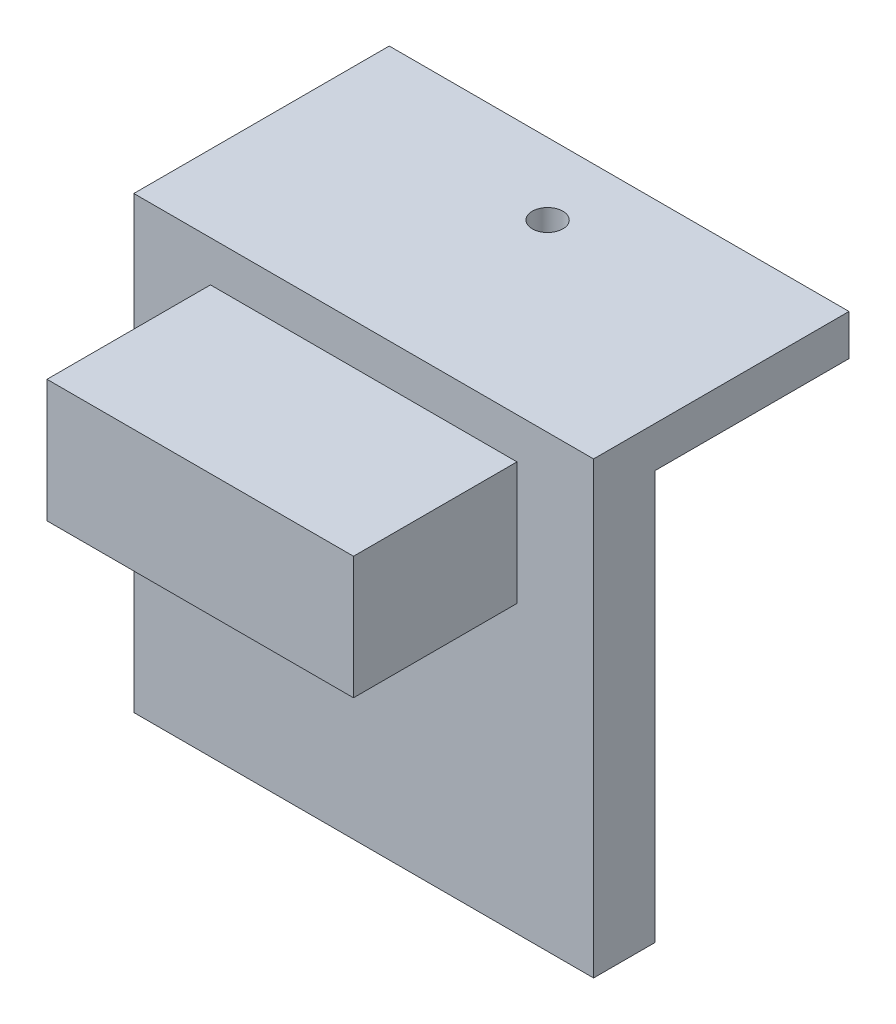
from build123d import *

# Parameters (mm, degrees)
SKETCH1_W           = 45
SKETCH1_H           = 40
BOSS_EXTRUDE1_DEPTH = 6
SKETCH2_W           = 30
SKETCH2_H           = 12
BOSS_EXTRUDE2_DEPTH = 16
SKETCH3_W           = 45
SKETCH3_H           = 25
SKETCH3_R           = 1.5
BOSS_EXTRUDE3_DEPTH = 4


with BuildPart() as part:
    # Sketch1 → Boss-Extrude1 (new body)
    with BuildSketch(Plane.XY):
        Rectangle(SKETCH1_W, SKETCH1_H)
    extrude(amount=BOSS_EXTRUDE1_DEPTH)

    # Sketch2 → Boss-Extrude2 (add)
    with BuildSketch(Plane.XY.offset(6)):
        with Locations((0, 14)):
            Rectangle(SKETCH2_W, SKETCH2_H)
    extrude(amount=BOSS_EXTRUDE2_DEPTH)

    # Sketch3 → Boss-Extrude3 (add)
    with BuildSketch(Plane(origin=(0, 20, 0), x_dir=(1, 0, 0), z_dir=(0, 1, 0))):
        with Locations((0, 6.5)):
            Rectangle(SKETCH3_W, SKETCH3_H)
        with Locations(Location((0, 12, 0), (0, 0, 270))):
            Circle(SKETCH3_R, mode=Mode.SUBTRACT)
    extrude(amount=BOSS_EXTRUDE3_DEPTH)


solid = part.part
